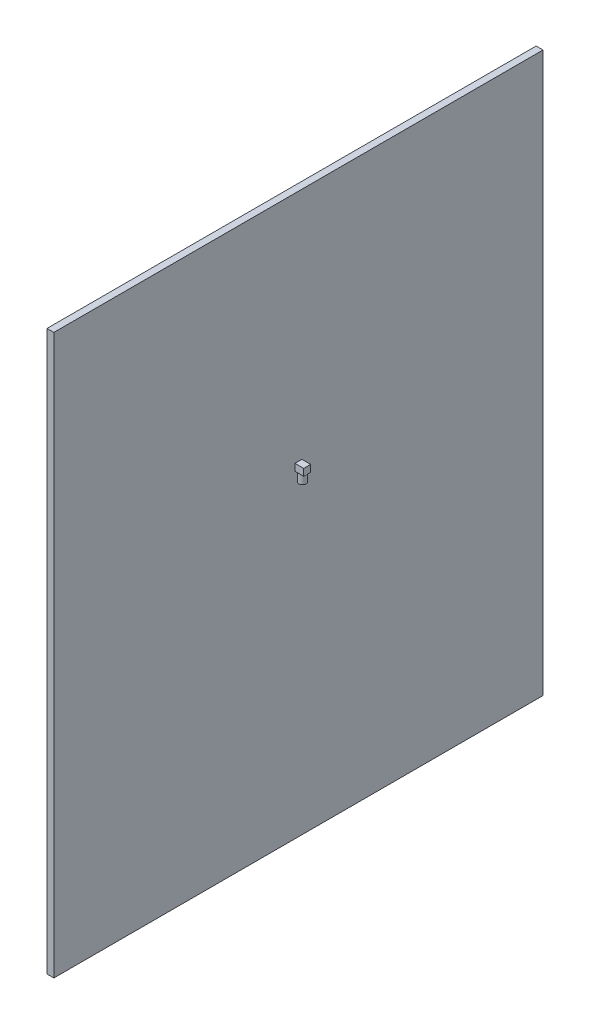
from build123d import *

# Parameters (mm, degrees)
SKETCH1_W           = 711.2
SKETCH1_H           = 812.8
BOSS_EXTRUDE1_DEPTH = 10
SKETCH2_W           = 10
SKETCH2_H           = 10
BOSS_EXTRUDE2_DEPTH = 12.7
SKETCH4_R           = 5.335
BOSS_EXTRUDE5_DEPTH = 12.7


with BuildPart() as part:
    # Sketch1 → Boss-Extrude1 (new body)
    with BuildSketch(Plane(origin=(0, 0, 0), x_dir=(0, 0, -1), z_dir=(1, 0, 0))):
        Rectangle(SKETCH1_W, SKETCH1_H)
    extrude(amount=BOSS_EXTRUDE1_DEPTH)

    # Sketch2 → Boss-Extrude2 (add)
    with BuildSketch(Plane(origin=(10, 0, 0), x_dir=(0, 0, -1), z_dir=(1, 0, 0))):
        with Locations((0, 61.3)):
            Rectangle(SKETCH2_W, SKETCH2_H)
    extrude(amount=BOSS_EXTRUDE2_DEPTH)

    # Sketch4 → Boss-Extrude5 (add)
    with BuildSketch(Plane.XZ.offset(-56.3)):
        with Locations(Location((16, 0, 0), (0, 0, 69.587697496))):
            Circle(SKETCH4_R)
    extrude(amount=BOSS_EXTRUDE5_DEPTH)


solid = part.part
